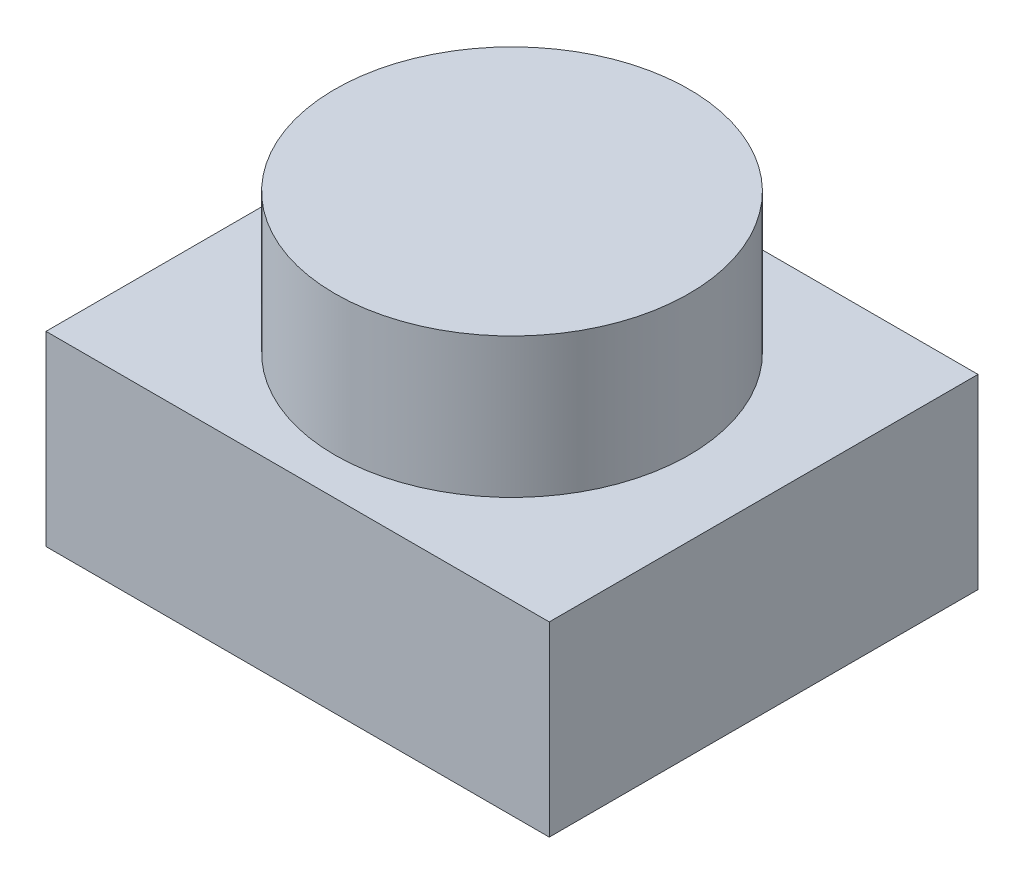
from build123d import *

# Parameters (mm, degrees)
SK_P01_BASE_W  = 54
SK_P01_BASE_H  = 46
P01_BASE_DEPTH = 20
P02_HEAD_START = 20
SK_P02_HEAD_R  = 19
P02_HEAD_DEPTH = 15


with BuildPart() as part:
    # SK_P01_Base → P01_Base (new body)
    with BuildSketch(Plane(origin=(0, 0, 0), x_dir=(1, 0, 0), z_dir=(0, 1, 0))):
        Rectangle(SK_P01_BASE_W, SK_P01_BASE_H)
    extrude(amount=P01_BASE_DEPTH)

    # SK_P02_Head → P02_Head (add)
    with BuildSketch(Plane(origin=(0, 0, 0), x_dir=(1, 0, 0), z_dir=(0, 1, 0)).offset(P02_HEAD_START)):
        with Locations(Location((0, 0, 0), (0, 0, 270))):
            Circle(SK_P02_HEAD_R)
    extrude(amount=P02_HEAD_DEPTH)


solid = part.part
